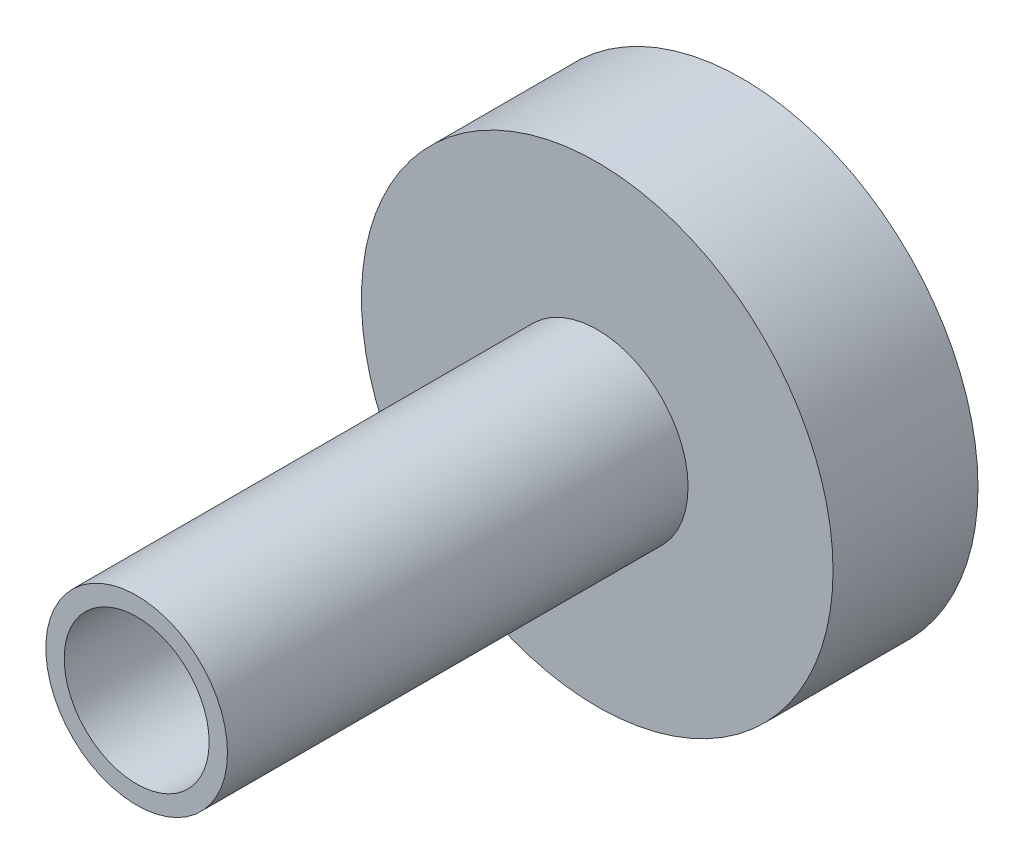
from build123d import *

# Parameters (mm, degrees)
SKETCH1_R           = 12.85
SKETCH1_R_2         = 3.95
BOSS_EXTRUDE1_DEPTH = 33
CUT_EXTRUDE1_START  = -25.1
SKETCH2_R           = 12.85
SKETCH2_R_2         = 4.95
CUT_EXTRUDE1_DEPTH  = 25.1


with BuildPart() as part:
    # Sketch1 → Boss-Extrude1 (new body)
    with BuildSketch(Plane.XY):
        Circle(SKETCH1_R)
        Circle(SKETCH1_R_2, mode=Mode.SUBTRACT)
    extrude(amount=BOSS_EXTRUDE1_DEPTH)

    # Sketch2 → Cut-Extrude1 (cut)
    with BuildSketch(Plane.XY.offset(33).offset(CUT_EXTRUDE1_START)):
        Circle(SKETCH2_R)
        Circle(SKETCH2_R_2, mode=Mode.SUBTRACT)
    extrude(amount=CUT_EXTRUDE1_DEPTH, mode=Mode.SUBTRACT)


solid = part.part
